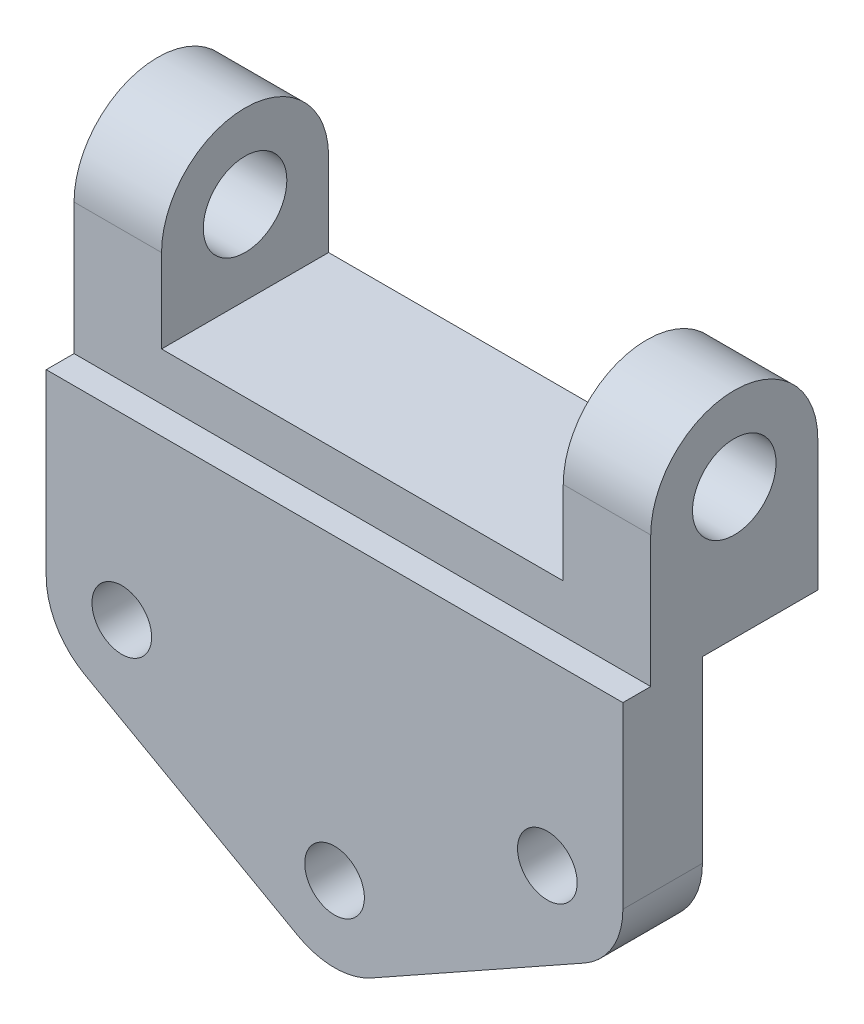
from build123d import *

# Parameters (mm, degrees)
SKETCH1_R           = 7.5
BOSS_EXTRUDE1_DEPTH = 20
SKETCH1_4_W         = 22
SKETCH1_4_H         = 54
BOSS_EXTRUDE3_DEPTH = 30
CUT_EXTRUDE6_REACH  = 184.102
SKETCH5_R           = 10.5


with BuildPart() as part:
    # Sketch1 → Boss-Extrude1 (new body)
    with BuildSketch(Plane.XY):
        with BuildLine():
            Line((72.5, -57), (72.5, -12))
            Line((72.5, -12), (-72.5, -12))
            Line((-72.5, -12), (-72.5, -57))
            ThreePointArc((-72.5, -57), (-69.894587599, -66.602994193), (-62.792895003, -73.572329422))
            Line((-62.792895003, -73.572329422), (-9.292895003, -103.572329422))
            ThreePointArc((-9.292895003, -103.572329422), (0, -106), (9.292895003, -103.572329422))
            Line((9.292895003, -103.572329422), (62.792895003, -73.572329422))
            ThreePointArc((62.792895003, -73.572329422), (69.894587599, -66.602994193), (72.5, -57))
        make_face()
        with Locations((-53.5, -57)):
            Circle(SKETCH1_R, mode=Mode.SUBTRACT)
        with Locations((0, -87)):
            Circle(SKETCH1_R, mode=Mode.SUBTRACT)
        with Locations((53.5, -57)):
            Circle(SKETCH1_R, mode=Mode.SUBTRACT)
    extrude(amount=BOSS_EXTRUDE1_DEPTH)

    # Sketch1<4> → Boss-Extrude3 (add, symmetric)
    with BuildSketch(Plane.XY):
        with Locations((-61.5, 27)):
            Rectangle(SKETCH1_4_W, SKETCH1_4_H)
        with Locations((61.5, 27)):
            Rectangle(SKETCH1_4_W, SKETCH1_4_H)
        Polygon((-72.5, -12), (0, -12), (0, 0), (-50.5, 0), (-72.5, 0), align=None)
        Polygon((0, 0), (0, -12), (72.5, -12), (72.5, 0), (50.5, 0), align=None)
    extrude(amount=BOSS_EXTRUDE3_DEPTH, both=True)

    # Cut-Extrude6: up to this face of the body (flat: up to its plane)
    cut_extrude6_end = Plane(part.part.faces().sort_by_distance((-72.5, 10.722222222, 1.851851852))[0])
    # Sketch5 → Cut-Extrude6 (cut, up to the picked face)
    with BuildSketch(Plane(origin=(72.5, 0, 0), x_dir=(0, 0, -1), z_dir=(1, 0, 0)), mode=Mode.PRIVATE) as cut_extrude6_sk1:
        with BuildLine():
            Line((-13, -12), (-13, 21))
            ThreePointArc((-13, 21), (8, 42), (29, 21))
            Line((29, 21), (29, -12))
            Line((29, -12), (30, -12))
            Line((30, -12), (30, 54))
            Line((30, 54), (-30, 54))
            Line((-30, 54), (-30, -12))
            Line((-30, -12), (-20, -12))
            Line((-20, -12), (-13, -12))
        make_face()
    cut_extrude6_tool1 = split(extrude(cut_extrude6_sk1.sketch, amount=-CUT_EXTRUDE6_REACH, mode=Mode.PRIVATE), bisect_by=cut_extrude6_end, keep=Keep.BOTH, mode=Mode.PRIVATE)
    # Sketch5 → Cut-Extrude6 (cut, up to the picked face)
    with BuildSketch(Plane(origin=(72.5, 0, 0), x_dir=(0, 0, -1), z_dir=(1, 0, 0)), mode=Mode.PRIVATE) as cut_extrude6_sk2:
        with Locations((8, 21)):
            Circle(SKETCH5_R)
    cut_extrude6_tool2 = split(extrude(cut_extrude6_sk2.sketch, amount=-CUT_EXTRUDE6_REACH, mode=Mode.PRIVATE), bisect_by=cut_extrude6_end, keep=Keep.BOTH, mode=Mode.PRIVATE)
    add(cut_extrude6_tool1.solids().sort_by(Axis((72.5, 4.5, 13.891964), (-1, 0, 0)))[0], mode=Mode.SUBTRACT)
    add(cut_extrude6_tool2.solids().sort_by(Axis((72.5, 21, -8), (-1, 0, 0)))[0], mode=Mode.SUBTRACT)


solid = part.part
